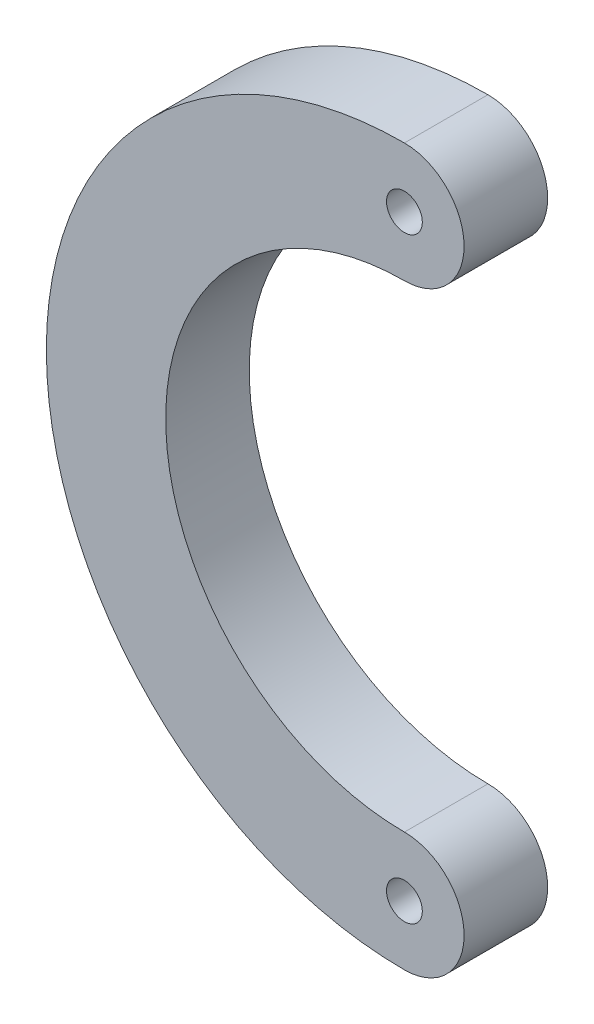
from build123d import *

# Parameters (mm, degrees)
BOSS_EXTRUDE1_DEPTH   = 7
F_3_0MM_DOWEL_HOLE1_D = 3


with BuildPart() as part:
    # Sketch1 → Boss-Extrude1 (new body)
    with BuildSketch(Plane.XY):
        with BuildLine():
            ThreePointArc((0, 30), (-30, 0), (0, -30))
            ThreePointArc((0, -30), (5, -25), (0, -20))
            ThreePointArc((0, -20), (-20, 0), (0, 20))
            ThreePointArc((0, 20), (5, 25), (0, 30))
        make_face()
    extrude(amount=BOSS_EXTRUDE1_DEPTH)

    # Ø3.0mm Dowel Hole1 (through all)
    with Locations(Plane.XY.offset(7)):
        with Locations((0, 25), (0, -25)):
            Hole(F_3_0MM_DOWEL_HOLE1_D / 2)


solid = part.part
